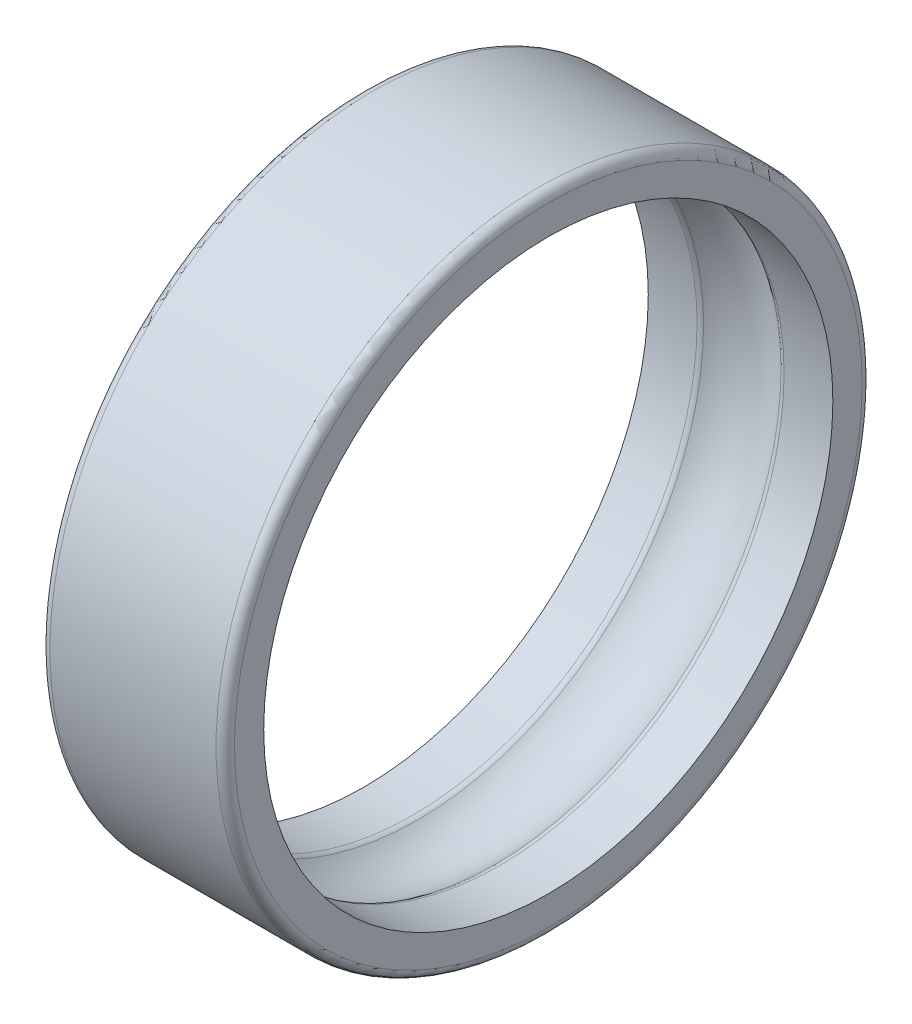
from build123d import *

# Parameters (mm, degrees)
FILLET2_R = 0.6
FILLET3_R = 0.5


with BuildPart() as part:
    # Sketch1 → Revolve1 (revolve)
    with BuildSketch(Plane.XY):
        with BuildLine():
            Line((6, 10.200814883), (-6, 10.200814883))
            Line((-6, 10.200814883), (-6, 7.700814883))
            Line((-6, 7.700814883), (-2.645751311, 7.700814883))
            ThreePointArc((-2.645751311, 7.700814883), (0, 8.700814883), (2.645751311, 7.700814883))
            Line((2.645751311, 7.700814883), (6, 7.700814883))
            Line((6, 7.700814883), (6, 10.200814883))
        make_face()
    revolve(axis=Axis((44.126443973, -10.799185117, 0), (-1, 0, 0)))

    # Fillet2
    fillet2_edges = [part.edges().sort_by_distance(p)[0] for p in [
        (-6, -31.799185117, 0),
        (6, -31.799185117, 0),
    ]]
    fillet(fillet2_edges, radius=FILLET2_R)

    # Fillet3
    fillet3_edges = [part.edges().sort_by_distance(p)[0] for p in [
        (-2.645751311, -29.299185117, 0),
        (2.645751311, -29.299185117, 0),
    ]]
    fillet(fillet3_edges, radius=FILLET3_R)


solid = part.part
